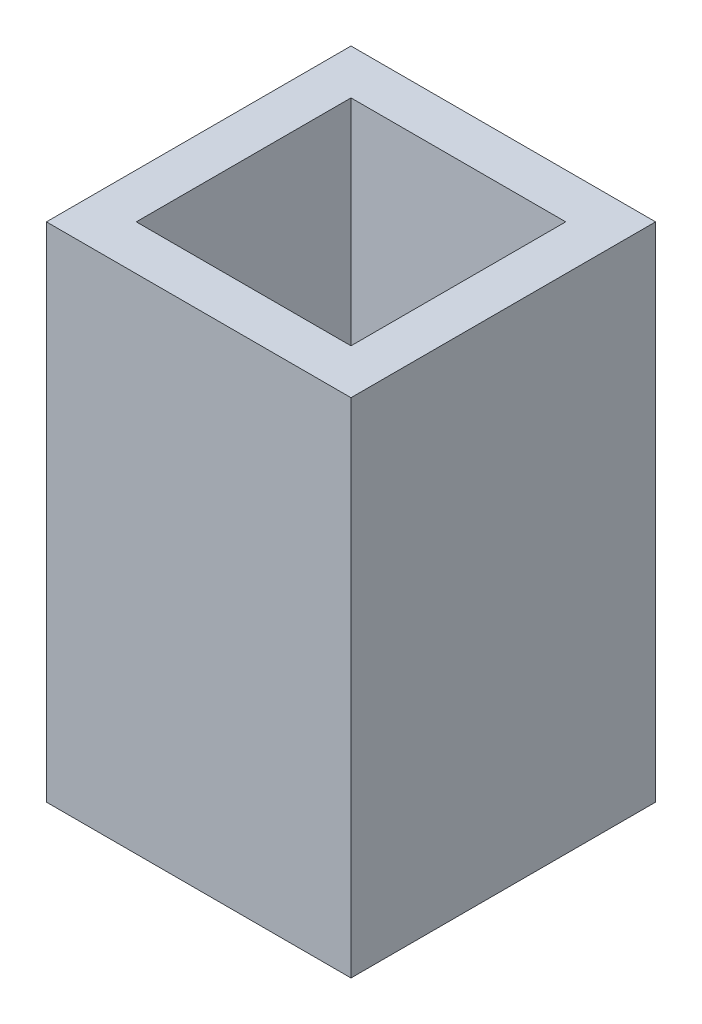
from build123d import *

# Parameters (mm, degrees)
SKETCH2_W           = 100
SKETCH2_H           = 100
BOSS_EXTRUDE1_DEPTH = 165
SKETCH3_W           = 70.5
SKETCH3_H           = 70.499969084
CUT_EXTRUDE1_DEPTH  = 164
CUT_EXTRUDE1_DRAFT  = -2


with BuildPart() as part:
    # Sketch2 → Boss-Extrude1 (new body)
    with BuildSketch(Plane.XZ.offset(2.5)):
        Rectangle(SKETCH2_W, SKETCH2_H)
    extrude(amount=BOSS_EXTRUDE1_DEPTH)


with BuildPart() as cut_extrude1_tool:
    # Sketch3 → Cut-Extrude1 (with draft: the straight prism first)
    with BuildSketch(Plane(origin=(0, -2.5, 0), x_dir=(1, 0, 0), z_dir=(0, 1, 0))):
        Rectangle(SKETCH3_W, SKETCH3_H)
    extrude(amount=-CUT_EXTRUDE1_DEPTH)
    # Cut-Extrude1: the draft: its side faces are tilted about the plane it starts from
    cut_extrude1_sides = [cut_extrude1_tool.faces().sort_by_distance(p)[0] for p in [
        (0, -84.5, 35.249984542),
        (35.25, -84.5, 0),
        (0, -84.5, -35.249984542),
        (-35.25, -84.5, 0),
    ]]
    draft(cut_extrude1_sides, Plane(origin=(0, -2.5, 0), x_dir=(1, 0, 0), z_dir=(0, 1, 0)), CUT_EXTRUDE1_DRAFT)


with BuildPart() as part_1:
    add(part.part)

    # Cut-Extrude1: cut by cut_extrude1_tool
    add(cut_extrude1_tool.part, mode=Mode.SUBTRACT)


solid = part_1.part
